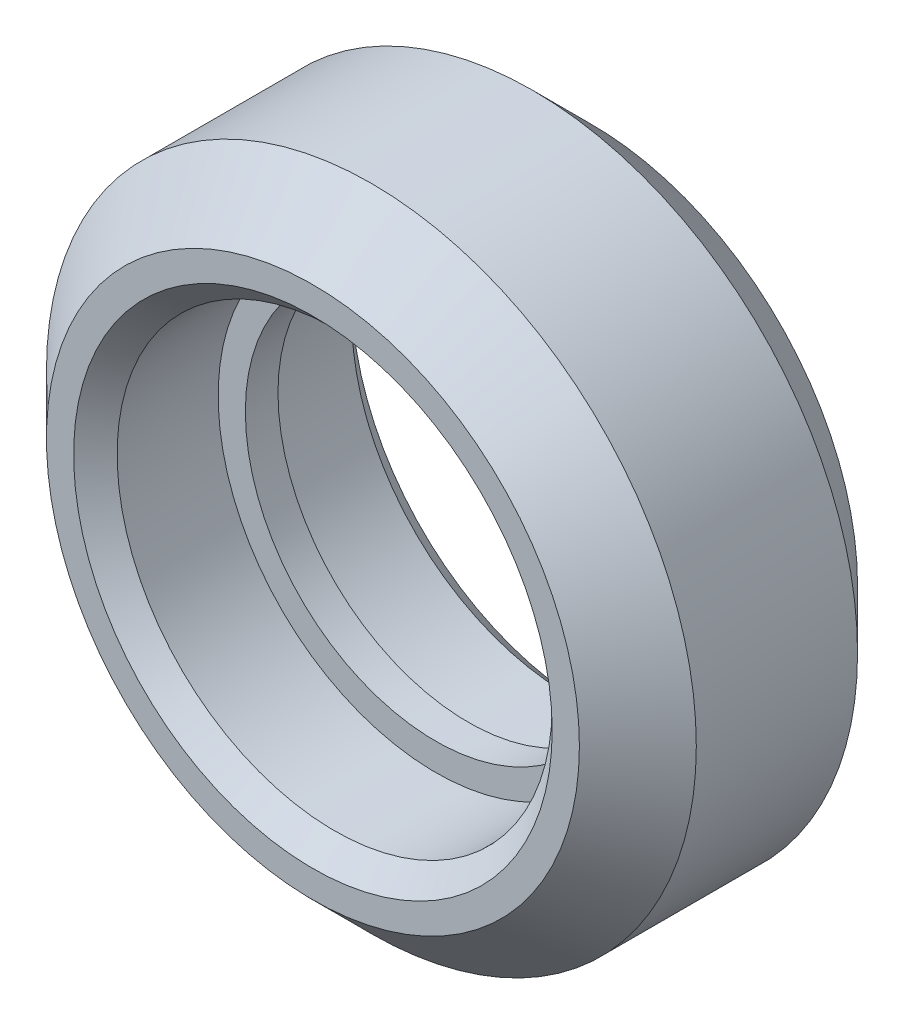
from build123d import *

# Parameters (mm, degrees)
SKETCH_1_R          = 11.95
EXTRUDE_1_DEPTH     = 10.23
SKETCH_2_R          = 7
CUT_EXTRUDE_1_DEPTH = 20.754946216
CHAMFER_1_SIZE      = 2.15
SKETCH_3_R          = 8
CUT_EXTRUDE_2_DEPTH = 4.515
CHAMFER_2_SIZE      = 0.8


with BuildPart() as part:
    # Эскиз1 → Бобышка-Вытянуть1 (new body)
    with BuildSketch(Plane.XY):
        Circle(SKETCH_1_R)
    extrude(amount=EXTRUDE_1_DEPTH)

    # Эскиз2 → Вырез-Вытянуть1 (cut, through all)
    with BuildSketch(Plane.XY.offset(10.23)):
        Circle(SKETCH_2_R)
    extrude(amount=-CUT_EXTRUDE_1_DEPTH, mode=Mode.SUBTRACT)

    # Фаска1
    chamfer_1_edges = [part.edges().sort_by_distance(p)[0] for p in [
        (-11.95, 0, 0),
        (-11.95, 0, 10.23),
    ]]
    chamfer(chamfer_1_edges, length=CHAMFER_1_SIZE)

    # Эскиз3 → Вырез-Вытянуть2 (cut)
    with BuildSketch(Plane.XY.offset(10.23)):
        Circle(SKETCH_3_R)
    cut_extrude_2 = extrude(amount=-CUT_EXTRUDE_2_DEPTH, mode=Mode.SUBTRACT)

    # Зеркальное отражение1: Вырез-Вытянуть2 across plane
    add(cut_extrude_2.mirror(Plane(origin=(0, 0, 5.115), x_dir=(1, 0, 0), z_dir=(0, 0, -1))), mode=Mode.SUBTRACT)

    # Фаска2
    chamfer_2_edges = [part.edges().sort_by_distance(p)[0] for p in [
        (-8, 0, 10.23),
        (-8, 0, 0),
    ]]
    chamfer(chamfer_2_edges, length=CHAMFER_2_SIZE)


solid = part.part
